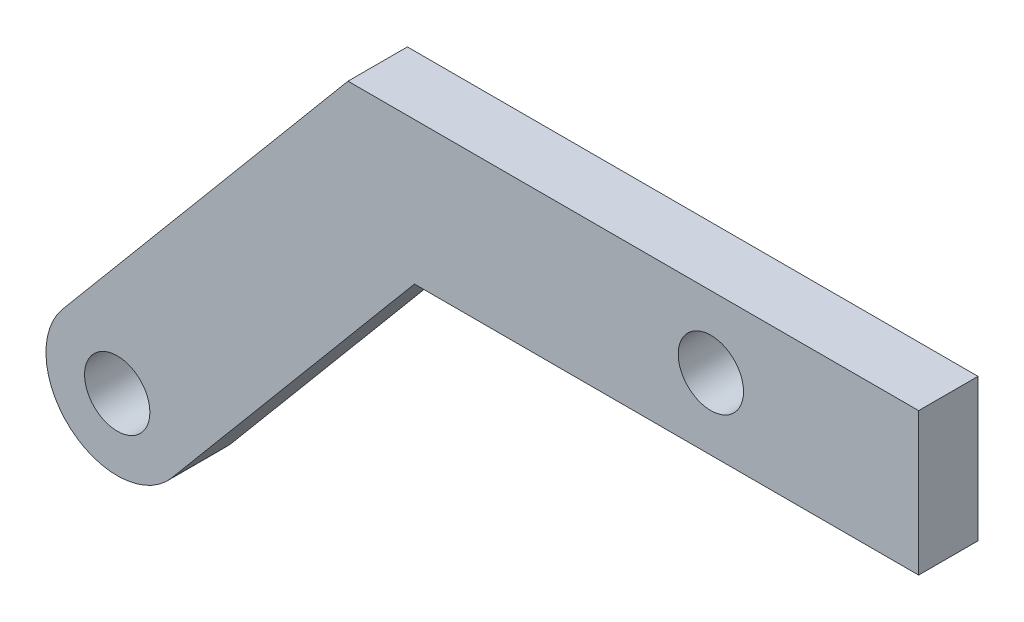
from build123d import *

# Parameters (mm, degrees)
SZKIC1_R                    = 5.5
DODANIE_WYCI_GNI_CIE1_DEPTH = 10


with BuildPart() as part:
    # Szkic1 → Dodanie-wyciągnięcie1 (new body)
    with BuildSketch(Plane.XY):
        with BuildLine():
            Line((38.876588555, 65), (-9.192533317, 7.713451316))
            ThreePointArc((-9.192533317, 7.713451316), (-7.713451316, -9.192533317), (9.192533317, -7.713451316))
            Line((9.192533317, -7.713451316), (50.06797235, 41))
            Line((50.06797235, 41), (135, 41))
            Line((135, 41), (135, 65))
            Line((135, 65), (38.876588555, 65))
        make_face()
        Circle(SZKIC1_R, mode=Mode.SUBTRACT)
        with Locations((100, 53)):
            Circle(SZKIC1_R, mode=Mode.SUBTRACT)
    extrude(amount=DODANIE_WYCI_GNI_CIE1_DEPTH)


solid = part.part
